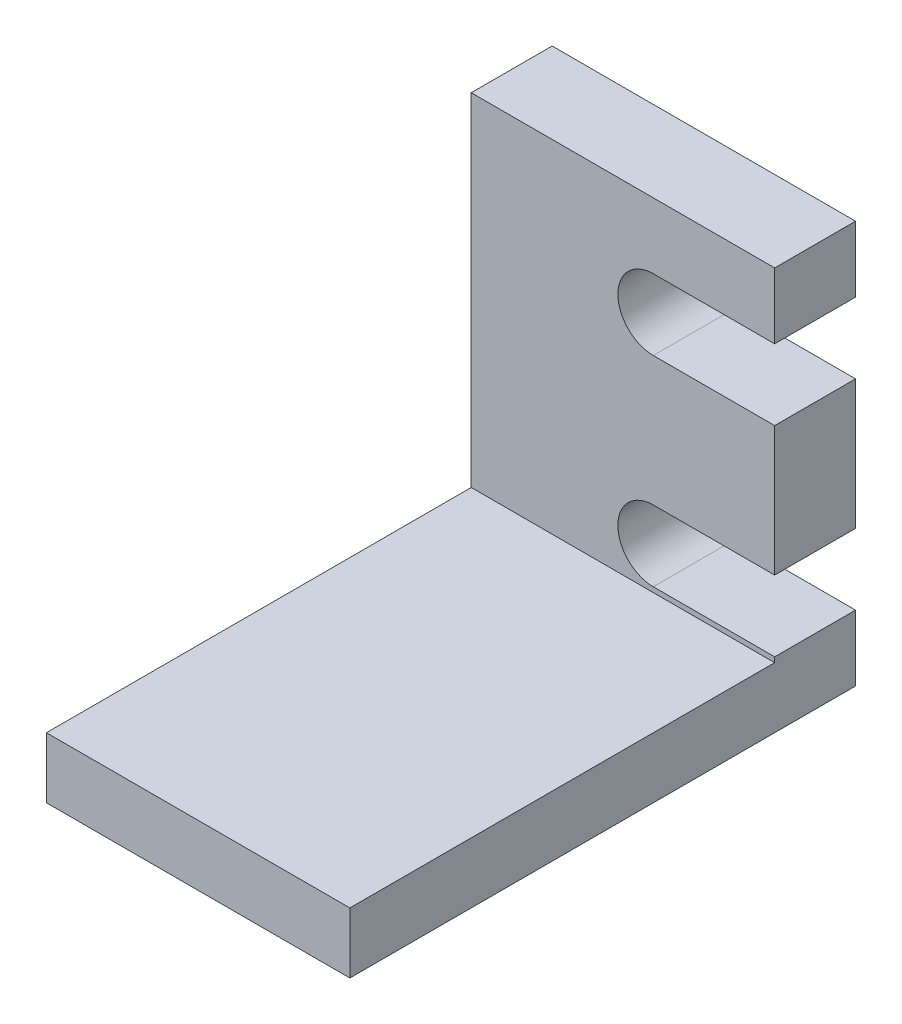
from build123d import *

# Parameters (mm, degrees)
ESTRUSIONE_ESTRUSIONE1_DEPTH = 4
SCHIZZO2_W                   = 15
SCHIZZO2_H                   = 3
ESTRUSIONE_ESTRUSIONE2_DEPTH = 21


with BuildPart() as part:
    # Schizzo1 → Estrusione-Estrusione1 (new body)
    with BuildSketch(Plane.XY):
        with BuildLine():
            Line((0, 19.9), (0, 0))
            Line((0, 0), (15, 0))
            Line((15, 0), (15, 3.25))
            Line((15, 3.25), (9, 3.25))
            ThreePointArc((9, 3.25), (7.25, 5), (9, 6.75))
            Line((9, 6.75), (15, 6.75))
            Line((15, 6.75), (15, 13.15))
            Line((15, 13.15), (9, 13.15))
            ThreePointArc((9, 13.15), (7.25, 14.9), (9, 16.65))
            Line((9, 16.65), (15, 16.65))
            Line((15, 16.65), (15, 19.9))
            Line((15, 19.9), (0, 19.9))
        make_face()
    extrude(amount=ESTRUSIONE_ESTRUSIONE1_DEPTH)

    # Schizzo2 → Estrusione-Estrusione2 (add)
    with BuildSketch(Plane.XY.offset(4)):
        with Locations((7.5, 1.5)):
            Rectangle(SCHIZZO2_W, SCHIZZO2_H)
    extrude(amount=ESTRUSIONE_ESTRUSIONE2_DEPTH)


solid = part.part
